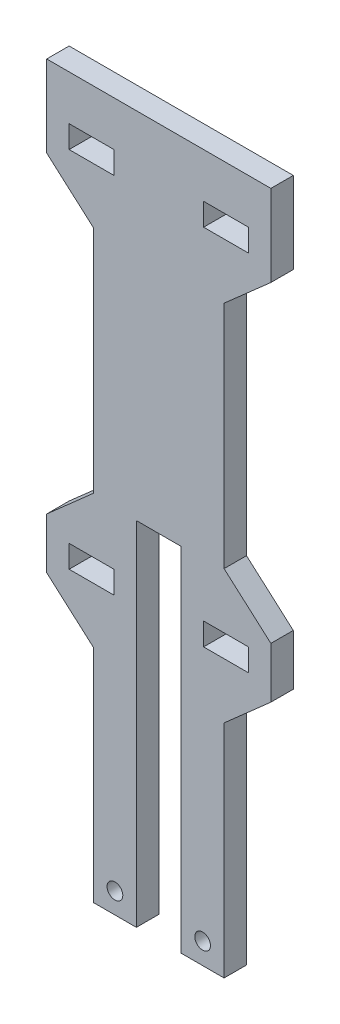
from build123d import *

# Parameters (mm, degrees)
SKETCH1_R           = 2.1
SKETCH1_W           = 12
SKETCH1_H           = 6
BOSS_EXTRUDE1_DEPTH = 6


with BuildPart() as part:
    # Sketch1 → Boss-Extrude1 (new body)
    with BuildSketch(Plane.XY):
        Polygon((24.958587154, 66.332129581), (-35.041412846, 66.332129581), (-35.041412846, 44.514954247), (-22.5134665, 33.454149031), (-22.5134665, -28.072174919), (-35.041412846, -39.132980135), (-35.041412846, -52.767330805), (-22.5134665, -63.828136021), (-22.5134665, -122.961056524), (-11.041412846, -122.961056524), (-11.041412846, -73.667870419), (-11.041412846, -28.667870419), (0.958587154, -28.667870419), (0.958587154, -73.667870419), (0.958587154, -122.961056524), (12.430640807, -122.961056524), (12.430640807, -63.828136021), (24.958587154, -52.767330805), (24.958587154, -39.132980135), (12.430640807, -28.072174919), (12.430640807, 33.454149031), (24.958587154, 44.514954247), align=None)
        with Locations((-16.777439673, -117.386123735)):
            Circle(SKETCH1_R, mode=Mode.SUBTRACT)
        with Locations((-23.041412846, -45.95015547)):
            Rectangle(SKETCH1_W, SKETCH1_H, mode=Mode.SUBTRACT)
        with Locations((6.69461398, -117.276997452)):
            Circle(SKETCH1_R, mode=Mode.SUBTRACT)
        with Locations((12.958587154, -45.95015547)):
            Rectangle(SKETCH1_W, SKETCH1_H, mode=Mode.SUBTRACT)
        with Locations((-23.041412846, 51.332129581)):
            Rectangle(SKETCH1_W, SKETCH1_H, mode=Mode.SUBTRACT)
        with Locations((12.958587154, 51.332129581)):
            Rectangle(SKETCH1_W, SKETCH1_H, mode=Mode.SUBTRACT)
    extrude(amount=BOSS_EXTRUDE1_DEPTH)


solid = part.part
